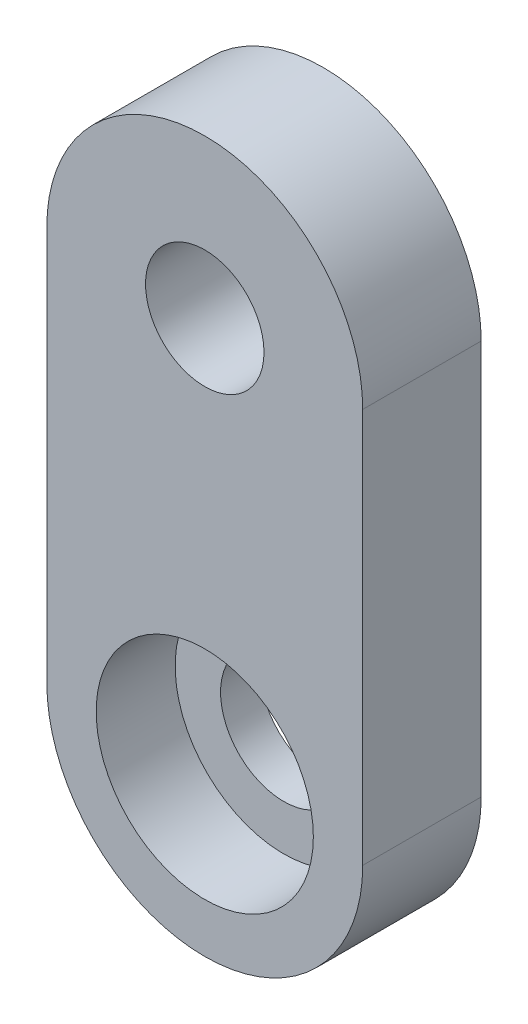
from build123d import *

# Parameters (mm, degrees)
BASE_DEPTH         = 3.81
METRIC_HOLES_REACH = 20.88
SKETCH3_R          = 2.032
SKETCH3_R_2        = 1.905
SKETCH4_R          = 3.4925
CUT_EXTRUDE2_DEPTH = 2.54


with BuildPart() as part:
    # Sketch2 → base (new body)
    with BuildSketch(Plane(origin=(0, 0, 0), x_dir=(0, 1, 0), z_dir=(0, 0, 1))):
        with BuildLine():
            Line((0, 5.08), (12.7, 5.08))
            ThreePointArc((12.7, 5.08), (17.78, 0), (12.7, -5.08))
            Line((12.7, -5.08), (0, -5.08))
            ThreePointArc((0, -5.08), (-5.08, 0), (0, 5.08))
        make_face()
    extrude(amount=BASE_DEPTH)

    # Sketch3 → metric_holes (cut, up to next)
    with BuildSketch(Plane.XY.offset(3.81), mode=Mode.PRIVATE) as metric_holes_sk1:
        Circle(SKETCH3_R)
    metric_holes_tool1 = extrude(metric_holes_sk1.sketch, amount=-METRIC_HOLES_REACH, mode=Mode.PRIVATE) & part.part
    # Sketch3 → metric_holes (cut, up to next)
    with BuildSketch(Plane.XY.offset(3.81), mode=Mode.PRIVATE) as metric_holes_sk2:
        with Locations((0, 12.7)):
            Circle(SKETCH3_R_2)
    metric_holes_tool2 = extrude(metric_holes_sk2.sketch, amount=-METRIC_HOLES_REACH, mode=Mode.PRIVATE) & part.part
    add(metric_holes_tool1.solids().sort_by_distance((0, 0, 3.81))[0], mode=Mode.SUBTRACT)
    add(metric_holes_tool2.solids().sort_by_distance((0, 12.7, 3.81))[0], mode=Mode.SUBTRACT)

    # Sketch4 → Cut-Extrude2 (cut)
    with BuildSketch(Plane.XY.offset(3.81)):
        Circle(SKETCH4_R)
    extrude(amount=-CUT_EXTRUDE2_DEPTH, mode=Mode.SUBTRACT)


solid = part.part
